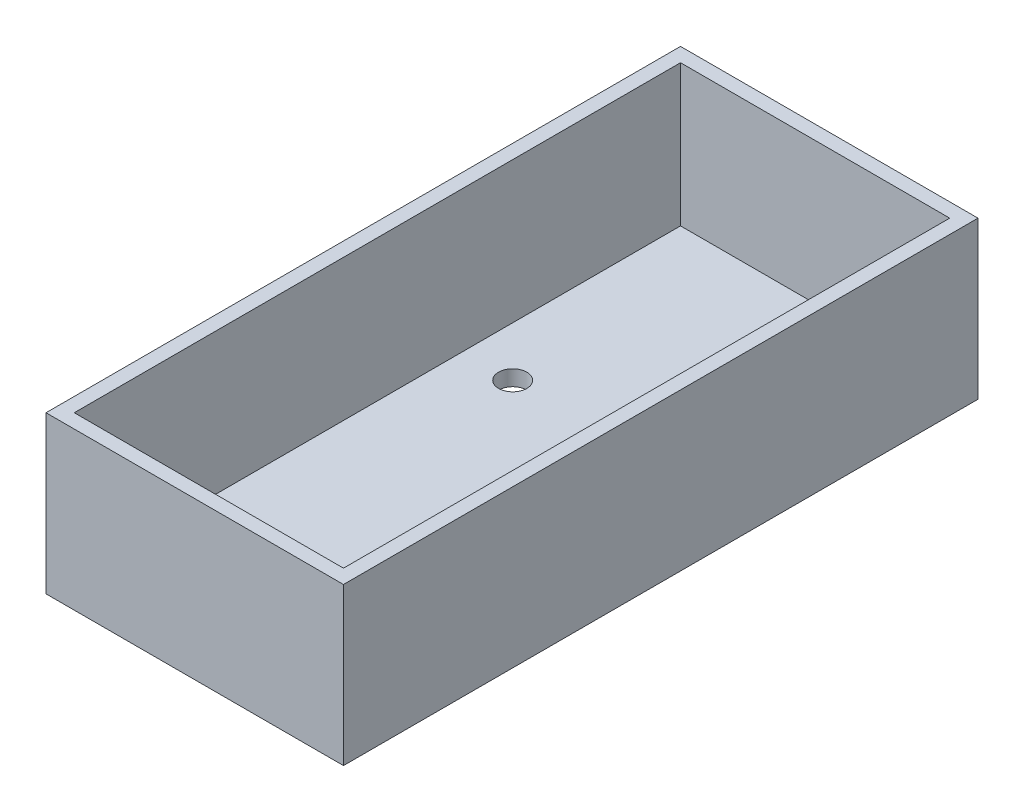
from build123d import *

# Parameters (mm, degrees)
SKETCH_1_W          = 42.1
SKETCH_1_H          = 89.8
EXTRUDE_1_DEPTH     = 22.2
SKETCH_2_W          = 38.1
SKETCH_2_H          = 85.8
CUT_EXTRUDE_1_DEPTH = 20
SKETCH_3_R          = 2
CUT_EXTRUDE_2_DEPTH = 54.47066953


with BuildPart() as part:
    # 스케치1 → 보스-돌출1 (new body)
    with BuildSketch(Plane(origin=(0, 0, 0), x_dir=(1, 0, 0), z_dir=(0, 1, 0))):
        Rectangle(SKETCH_1_W, SKETCH_1_H)
    extrude(amount=EXTRUDE_1_DEPTH)

    # 스케치2 → 컷-돌출1 (cut)
    with BuildSketch(Plane(origin=(0, 22.2, 0), x_dir=(1, 0, 0), z_dir=(0, 1, 0))):
        Rectangle(SKETCH_2_W, SKETCH_2_H)
    extrude(amount=-CUT_EXTRUDE_1_DEPTH, mode=Mode.SUBTRACT)

    # 스케치3 → 컷-돌출2 (cut, through all)
    with BuildSketch(Plane(origin=(0, 2.2, 0), x_dir=(1, 0, 0), z_dir=(0, 1, 0))):
        with Locations(Location((-12, -27.9, 0), (0, 0, 270))):
            Circle(SKETCH_3_R)
        with Locations(Location((-12, 12.1, 0), (0, 0, 270))):
            Circle(SKETCH_3_R)
        with Locations(Location((12, 12.1, 0), (0, 0, 270))):
            Circle(SKETCH_3_R)
        with Locations(Location((12, -27.9, 0), (0, 0, 270))):
            Circle(SKETCH_3_R)
    extrude(amount=-CUT_EXTRUDE_2_DEPTH, mode=Mode.SUBTRACT)


solid = part.part
